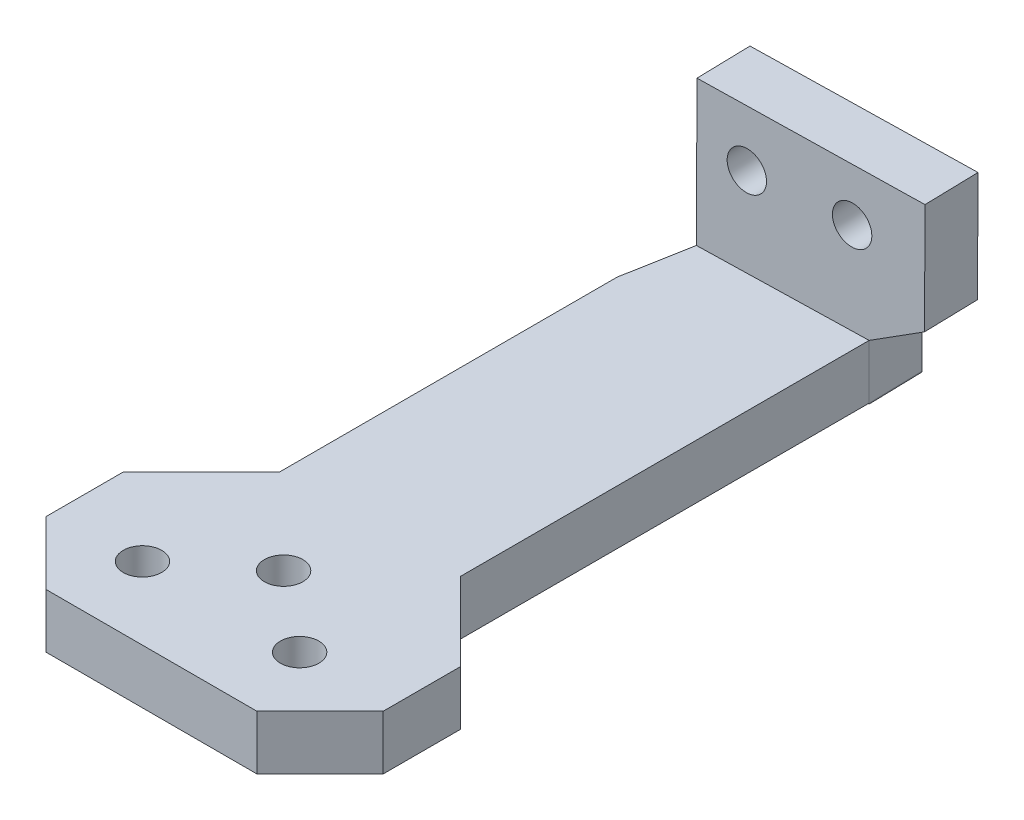
from build123d import *

# Parameters (mm, degrees)
SKETCH1_W           = 39.399758744
SKETCH1_H           = 111.953636544
BOSS_EXTRUDE1_DEPTH = 6.35
SKETCH2_R           = 2.2479
CUT_EXTRUDE1_DEPTH  = 6.35
SKETCH3_W           = 71.072675824
SKETCH3_H           = 134.223238101
CUT_EXTRUDE2_DEPTH  = 100.567056099
BOSS_EXTRUDE2_DEPTH = 6.35
CUT_EXTRUDE3_DEPTH  = 17.78
CUT_EXTRUDE4_DEPTH  = 17.78
SKETCH8_R           = 2.2479
CUT_EXTRUDE5_DEPTH  = 17.78
CUT_EXTRUDE6_DEPTH  = 17.78


with BuildPart() as part:
    # Sketch1 → Boss-Extrude1 (new body)
    with BuildSketch(Plane(origin=(0, 0, 0), x_dir=(1, 0, 0), z_dir=(0, 1, 0))):
        with Locations((0, -41.415126533)):
            Rectangle(SKETCH1_W, SKETCH1_H)
    extrude(amount=BOSS_EXTRUDE1_DEPTH)

    # Sketch2 → Cut-Extrude1 (cut)
    with BuildSketch(Plane.XZ):
        with Locations(Location((-9.529205928, 88.917973315, 0), (0, 0, 270))):
            Circle(SKETCH2_R)
        with Locations(Location((-0.345903119, 81.607097845, 0), (0, 0, 270))):
            Circle(SKETCH2_R)
        with Locations(Location((8.83739969, 88.917973315, 0), (0, 0, 270))):
            Circle(SKETCH2_R)
        with Locations(Location((-6.801328812, 8.792914394, 0), (0, 0, 270))):
            Circle(SKETCH2_R)
        with Locations(Location((6.806799476, 8.458800444, 0), (0, 0, 270))):
            Circle(SKETCH2_R)
        with Locations(Location((6.464434774, -5.485372764, 0), (0, 0, 270))):
            Circle(SKETCH2_R)
        with Locations(Location((-7.143693514, -5.151258814, 0), (0, 0, 270))):
            Circle(SKETCH2_R)
    extrude(amount=-CUT_EXTRUDE1_DEPTH, mode=Mode.SUBTRACT)

    # Sketch3 → Cut-Extrude2 (cut, through all)
    with BuildSketch(Plane(origin=(0, 6.35, 0), x_dir=(1, 0, 0), z_dir=(0, 1, 0))):
        with Locations((6.224517787, -42.761697159)):
            Rectangle(SKETCH3_W, SKETCH3_H)
        Polygon((-12.327042075, 14.561691739), (-19.699879372, 7.188854442), (-19.699879372, -12.745041988), (-10.566484546, -21.878436814), (-10.566484546, -71.843509551), (-19.699879372, -80.976904376), (-19.699879372, -90.019107509), (-12.327042075, -97.391944805), (12.327042075, -97.391944805), (19.699879372, -90.019107509), (19.699879372, -80.976904376), (10.566484546, -71.843509551), (10.566484546, -21.878436814), (19.699879372, -12.745041988), (19.699879372, 7.188854442), (12.327042075, 14.561691739), align=None, mode=Mode.SUBTRACT)
    extrude(amount=-CUT_EXTRUDE2_DEPTH, mode=Mode.SUBTRACT)

    # Sketch4 → Boss-Extrude2 (add)
    with BuildSketch(Plane(origin=(0.441730074, 0, 17.991225794), x_dir=(0.9996987228929893, 0, -0.02454513080279466), z_dir=(0.024545130802794655, 0, 0.9996987228929893))):
        Polygon((16.34805073, 23.203681401), (-9.66660969, 23.318089373), (-9.769158609, 0), (16.245501812, -0.114407971), align=None)
    extrude(amount=BOSS_EXTRUDE2_DEPTH)

    # Sketch5 → Cut-Extrude3 (cut)
    with BuildSketch(Plane(origin=(0, 6.35, 0), x_dir=(1, 0, 0), z_dir=(0, 1, 0))):
        Polygon((-34.038749138, -18.837808723), (44.238409571, -16.915906598), (43.332381283, 19.985722858), (-34.944777425, 18.063820734), align=None)
    extrude(amount=-CUT_EXTRUDE3_DEPTH, mode=Mode.SUBTRACT)

    # Sketch7 → Cut-Extrude4 (cut)
    with BuildSketch(Plane(origin=(0, 6.35, 0), x_dir=(1, 0, 0), z_dir=(0, 1, 0))):
        Polygon((-9.221967288, -18.228493993), (-9.140705944, -24.578412508), (-10.566484546, -32.408675366), (-20.665804385, -15.813545517), align=None)
    extrude(amount=-CUT_EXTRUDE4_DEPTH, mode=Mode.SUBTRACT)

    # Sketch8 → Cut-Extrude5 (cut)
    with BuildSketch(Plane(origin=(0.597591654, 0, 24.339312685), x_dir=(0.9996987228929893, 0, -0.02454513080279456), z_dir=(0.024545130802794555, 0, 0.9996987228929893))):
        with Locations((8.032860697, 17.084635325)):
            Circle(SKETCH8_R)
        with Locations((-3.981044382, 16.728237268)):
            Circle(SKETCH8_R)
    extrude(amount=-CUT_EXTRUDE5_DEPTH, mode=Mode.SUBTRACT)

    # Sketch10 → Cut-Extrude6 (cut)
    with BuildSketch(Plane(origin=(0.597591654, 0, 24.339312685), x_dir=(0.9996987228929893, 0, -0.02454513080279456), z_dir=(0.024545130802794555, 0, 0.9996987228929893))):
        Polygon((9.971897196, 6.35), (16.291284894, 10.295979795), (16.245501812, -0.114407971), (19.257293788, -2.586211701), (10.442142757, -4.912057873), (9.971897196, 0), align=None)
    extrude(amount=-CUT_EXTRUDE6_DEPTH, mode=Mode.SUBTRACT)


solid = part.part
